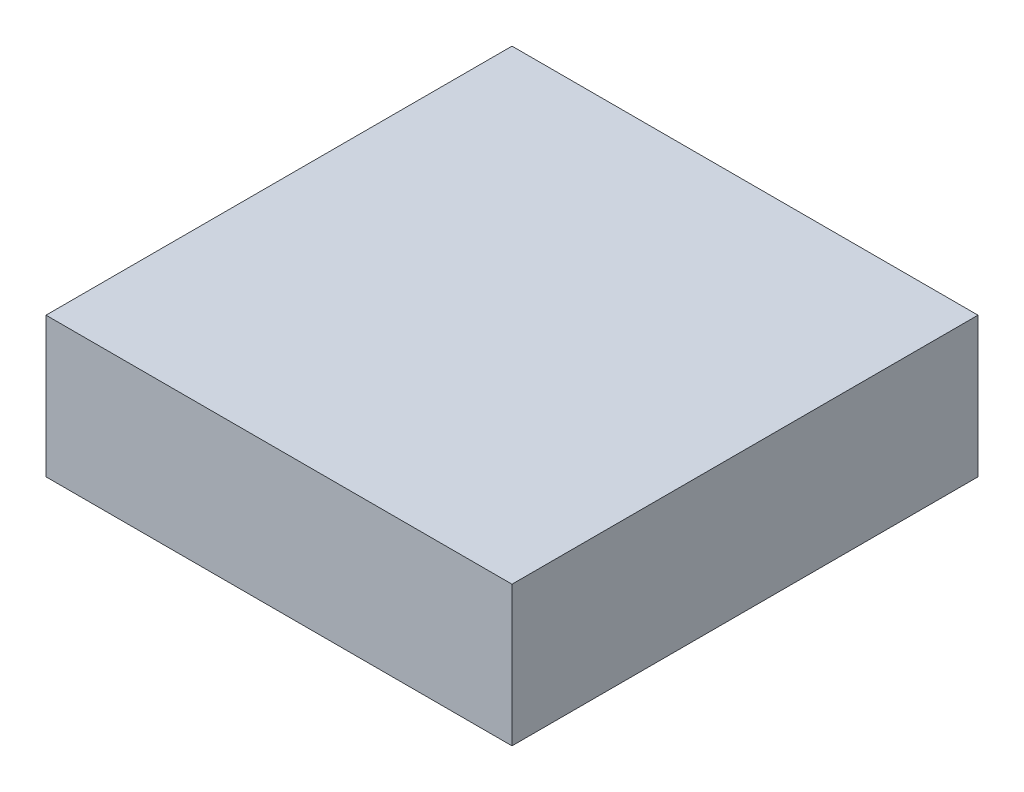
from build123d import *

# Parameters (mm, degrees)
SKETCH1_W           = 40.6
SKETCH1_H           = 40.6
BOSS_EXTRUDE1_DEPTH = 12.2


with BuildPart() as part:
    # Sketch1 → Boss-Extrude1 (new body)
    with BuildSketch(Plane(origin=(0, 0, 0), x_dir=(1, 0, 0), z_dir=(0, 1, 0))):
        Rectangle(SKETCH1_W, SKETCH1_H)
    extrude(amount=BOSS_EXTRUDE1_DEPTH)


solid = part.part
